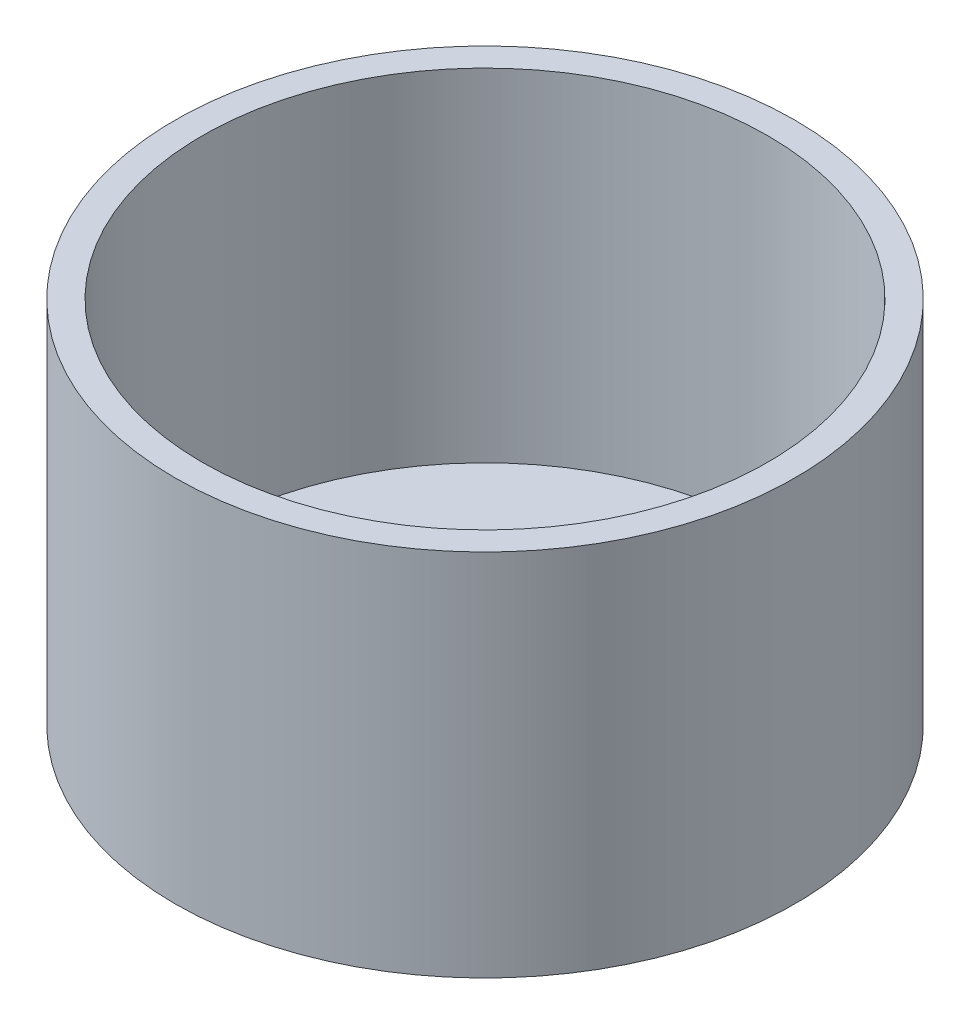
from build123d import *

# Parameters (mm, degrees)
SKETCH_2_R               = 2.2
SKETCH_2_R_2             = 1.55
CUT_EXTRUDE_1_DEPTH      = 47.584117465
PATTERN_CIRCULAR_1_COUNT = 4


with BuildPart() as part:
    # 草图1 → 旋转1 (revolve)
    with BuildSketch(Plane.XY, mode=Mode.PRIVATE) as revolve_1_sk:
        Polygon((0, 0), (25.2, 0), (25.2, 30), (23, 30), (23, 2.2), (0, 2.2), align=None)
    revolve(revolve_1_sk.sketch.rotate(Axis((0, 2.2, 0), (0, -1, 0)), 90), axis=Axis((0, 2.2, 0), (0, -1, 0)))

    # 草图2 → 切除-拉伸1 (cut, through all)
    with BuildSketch(Plane.XZ):
        with Locations(Location((0, 0, 0), (0, 0, 270))):
            Circle(SKETCH_2_R)
        with Locations(Location((8.5, 0, 0), (0, 0, 270))):
            Circle(SKETCH_2_R_2)
    cut_extrude_1 = extrude(amount=-CUT_EXTRUDE_1_DEPTH, mode=Mode.SUBTRACT)

    # 阵列(圆周)1: 切除-拉伸1 ×4 about axis
    pattern_circular_1_axis = Axis((0, 0, 0), (0, 1, 0))
    for i in range(1, PATTERN_CIRCULAR_1_COUNT):
        add(cut_extrude_1.rotate(pattern_circular_1_axis, i * 360 / PATTERN_CIRCULAR_1_COUNT), mode=Mode.SUBTRACT)


solid = part.part
